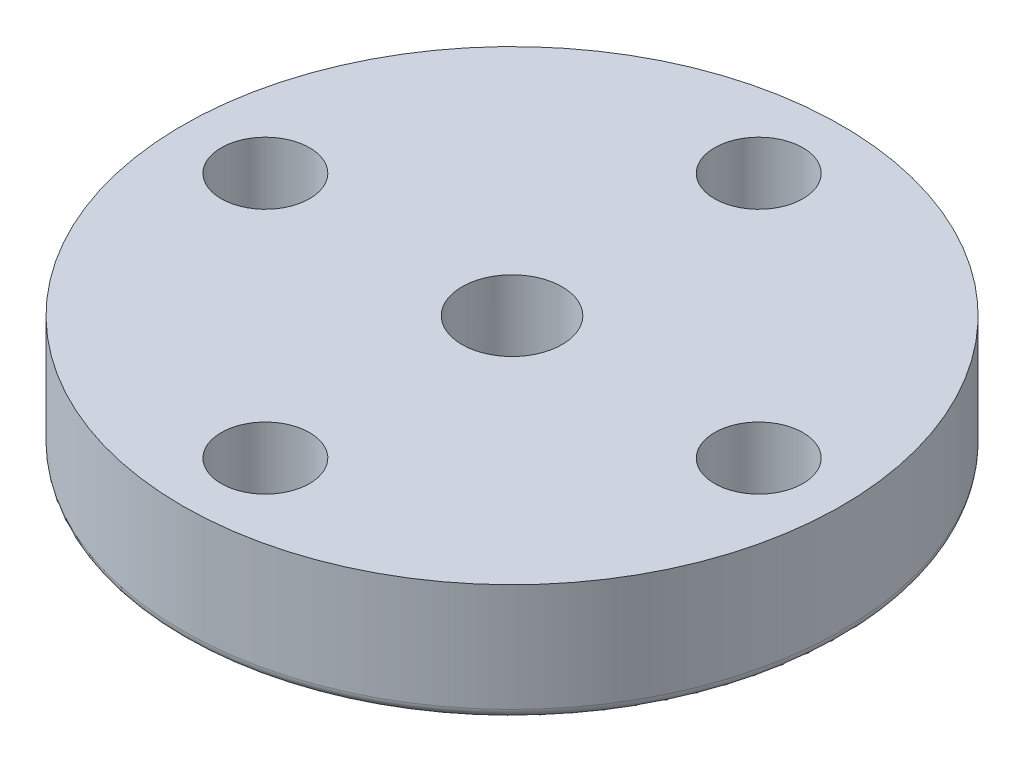
from build123d import *

# Parameters (mm, degrees)
SKETCH1_R           = 8.39
BOSS_EXTRUDE1_DEPTH = 3
SKETCH2_R           = 4.5
BOSS_EXTRUDE2_DEPTH = 2.5
SKETCH3_R           = 1.125
CUT_EXTRUDE1_DEPTH  = 13.238635545
FILLET1_R           = 0.25
SKETCH6_R           = 1.275
CUT_EXTRUDE2_DEPTH  = 14.078004435
SKETCH7_R           = 3.11
CUT_EXTRUDE3_DEPTH  = 2.5
BOSS_EXTRUDE4_DEPTH = 2.5
CIRPATTERN1_COUNT   = 26


with BuildPart() as part:
    # Sketch1 → Boss-Extrude1 (new body)
    with BuildSketch(Plane(origin=(0, 0, 0), x_dir=(1, 0, 0), z_dir=(0, 1, 0))):
        with Locations(Location((0, 0, 0), (0, 0, 270))):
            Circle(SKETCH1_R)
    extrude(amount=BOSS_EXTRUDE1_DEPTH)

    # Sketch2 → Boss-Extrude2 (add)
    with BuildSketch(Plane(origin=(0, 0, 0), x_dir=(1, 0, 0), z_dir=(0, 1, 0))):
        with Locations(Location((0, 0, 0), (0, 0, 270))):
            Circle(SKETCH2_R)
    extrude(amount=-BOSS_EXTRUDE2_DEPTH)

    # Sketch3 → Cut-Extrude1 (cut, through all)
    with BuildSketch(Plane(origin=(0, 0, 0), x_dir=(1, 0, 0), z_dir=(0, 1, 0))):
        with Locations(Location((0, 6.28, 0), (0, 0, 270))):
            Circle(SKETCH3_R)
        with Locations(Location((-6.28, 0, 0), (0, 0, 270))):
            Circle(SKETCH3_R)
        with Locations(Location((0, -6.28, 0), (0, 0, 90))):
            Circle(SKETCH3_R)
        with Locations(Location((6.28, 0, 0), (0, 0, 90))):
            Circle(SKETCH3_R)
    extrude(amount=CUT_EXTRUDE1_DEPTH, mode=Mode.SUBTRACT)

    # Fillet1
    fillet1_edges = [part.edges().sort_by_distance(p)[0] for p in [
        (0, 0, -8.39),
    ]]
    fillet(fillet1_edges, radius=FILLET1_R)

    # Sketch6 → Cut-Extrude2 (cut, through all)
    with BuildSketch(Plane(origin=(0, 3, 0), x_dir=(1, 0, 0), z_dir=(0, 1, 0))):
        with Locations(Location((0, 0, 0), (0, 0, 270))):
            Circle(SKETCH6_R)
    extrude(amount=-CUT_EXTRUDE2_DEPTH, mode=Mode.SUBTRACT)

    # Sketch7 → Cut-Extrude3 (cut)
    with BuildSketch(Plane.XZ.offset(2.5)):
        with Locations(Location((0, 0, 0), (0, 0, 270))):
            Circle(SKETCH7_R)
    extrude(amount=-CUT_EXTRUDE3_DEPTH, mode=Mode.SUBTRACT)

    # Sketch8 → Boss-Extrude4 (add)
    with BuildSketch(Plane.XZ.offset(2.5)):
        with BuildLine():
            Line((2.580937562, 1.000063428), (2.97197515, 0.880119756))
            ThreePointArc((2.97197515, 0.880119756), (2.88046583, 1.126882202), (2.766961985, 1.364332277))
            Line((2.766961985, 1.364332277), (2.580937562, 1.000063428))
        make_face()
    boss_extrude4 = extrude(amount=-BOSS_EXTRUDE4_DEPTH)

    # CirPattern1: Boss-Extrude4 ×26 about axis
    cirpattern1_axis = Axis((0, 0, 0), (0, 1, 0))
    for i in range(1, CIRPATTERN1_COUNT):
        add(boss_extrude4.rotate(cirpattern1_axis, i * 360 / CIRPATTERN1_COUNT))


solid = part.part
